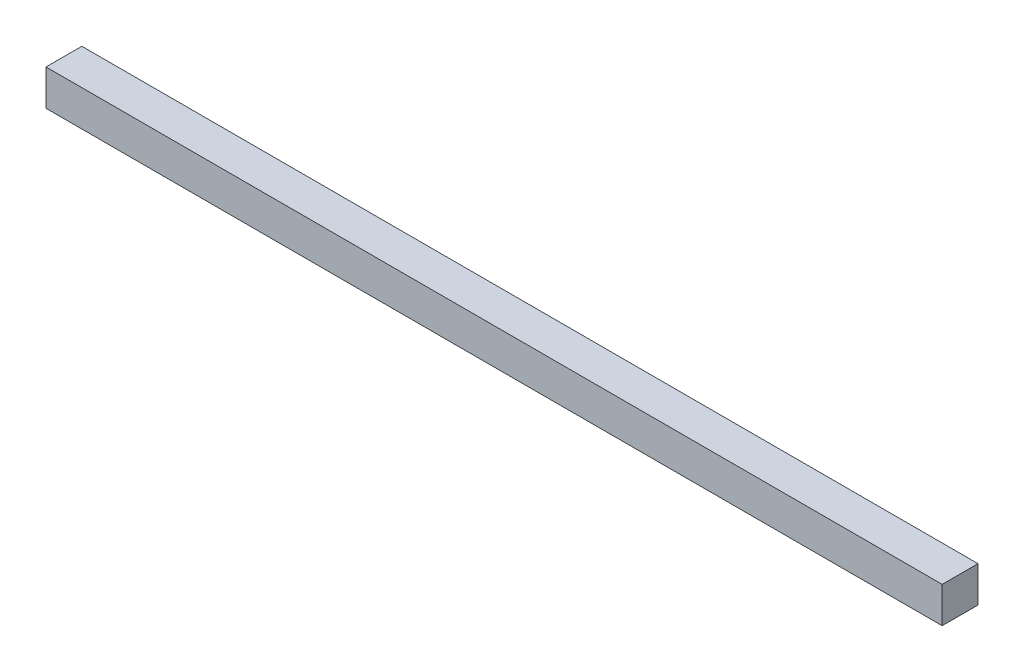
from build123d import *

# Parameters (mm, degrees)
SKETCH_1_W      = 500
SKETCH_1_H      = 20
EXTRUDE_1_DEPTH = 20


with BuildPart() as part:
    # 草图1 → 凸台-拉伸1 (new body)
    with BuildSketch(Plane(origin=(0, 0, 0), x_dir=(1, 0, 0), z_dir=(0, 1, 0))):
        with Locations((-350, -210)):
            Rectangle(SKETCH_1_W, SKETCH_1_H)
    extrude(amount=EXTRUDE_1_DEPTH)


solid = part.part
